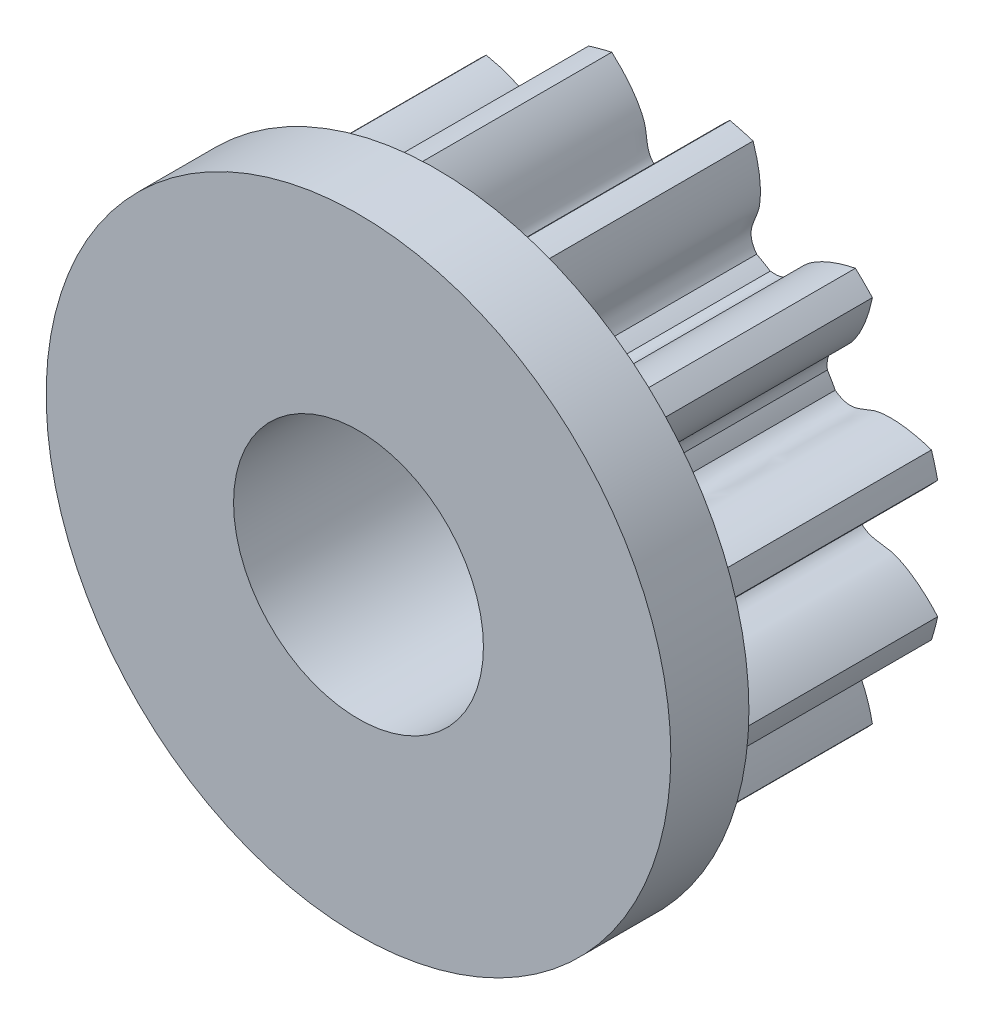
from build123d import *

# Parameters (mm, degrees)
SKETCH_1_R               = 3.5
EXTRUDE_1_DEPTH          = 3
CUT_EXTRUDE_1_DEPTH      = 6.787918451
PATTERN_CIRCULAR_1_COUNT = 12
SKETCH_5_R               = 4
EXTRUDE_2_DEPTH          = 1
SKETCH_6_R               = 1.6
CUT_EXTRUDE_2_DEPTH      = 10


with BuildPart() as part:
    # 草图1 → 凸台-拉伸1 (new body)
    with BuildSketch(Plane.XY):
        Circle(SKETCH_1_R)
    extrude(amount=EXTRUDE_1_DEPTH)

    # 草图2 → 切除-拉伸1 (cut, through all)
    with BuildSketch(Plane.XY):
        with BuildLine():
            ThreePointArc((0.100420056, 2.372876063), (0, 2.375), (-0.100420056, 2.372876063))
            add(Edge.make_bspline(
                [(-0.100420056, 2.372876063), (-0.340394435, 2.474653731), (-0.287186739, 2.672409341), (-0.338076094, 2.844740289), (-0.341311927, 2.854952869), (-0.345113625, 2.866166713), (-0.349521434, 2.878363044), (-0.354576313, 2.891521619), (-0.360318258, 2.905621034), (-0.36678678, 2.920638648), (-0.374020716, 2.936550626), (-0.382058239, 2.95333195), (-0.390936819, 2.970956436), (-0.400693193, 2.989396753), (-0.411363332, 3.008624444), (-0.422982412, 3.02860994), (-0.435584786, 3.049322589), (-0.449203949, 3.07073067), (-0.463872517, 3.092801417), (-0.479622192, 3.115501045), (-0.496483738, 3.138794769), (-0.514486952, 3.162646832), (-0.533660639, 3.187020528), (-0.554032585, 3.211878226), (-0.575629533, 3.237181399), (-0.598477155, 3.262890651), (-0.622600033, 3.288965742), (-0.648021632, 3.315365616), (-0.674764279, 3.342048434), (-0.702849139, 3.368971597), (-0.732296196, 3.396091781), (-0.763124233, 3.423364967), (-0.795350811, 3.450746465), (-0.828992247, 3.478190957), (-0.864063604, 3.505652518), (-0.900578664, 3.533084654), (-0.938549918, 3.560440334), (-0.977988547, 3.587672024), (-1.01890441, 3.614731718), (-1.061306025, 3.641570973), (-1.10520056, 3.668140947), (-1.150593819, 3.694392428), (-1.197490231, 3.720275872), (-1.245892835, 3.74574144), (-1.295803277, 3.770739031), (-1.347221796, 3.79521832), (-1.400147219, 3.819128792), (-1.454576948, 3.842419781), (-1.510506963, 3.865040505), (-1.567931802, 3.886940103), (-1.647189853, 3.915363979), (-1.7077968, 3.935050704), (-1.748802701, 3.947485455)],
                knots=[0, 0, 0, 0, 0.218015236, 0.222043642, 0.226545979, 0.231522246, 0.236972443, 0.24289657, 0.249294627, 0.256166614, 0.263512532, 0.271332379, 0.279626157, 0.288393865, 0.297635503, 0.307351072, 0.31754057, 0.328203999, 0.339341357, 0.350952646, 0.363037866, 0.375597015, 0.388630094, 0.402137104, 0.416118043, 0.430572913, 0.445501713, 0.460904444, 0.476781104, 0.493131694, 0.509956215, 0.527254666, 0.545027047, 0.563273358, 0.581993599, 0.601187771, 0.620855872, 0.640997904, 0.661613866, 0.682703758, 0.704267581, 0.726305333, 0.748817015, 0.771802628, 0.795262171, 0.819195644, 0.843603047, 0.868484381, 0.893839644, 0.919668838, 0.945971962, 1, 1, 1, 1], degree=3))
            ThreePointArc((-1.748802701, 3.947485455), (0, 4.317516914), (1.748802701, 3.947485455))
            add(Edge.make_bspline(
                [(0.100420056, 2.372876063), (0.340394435, 2.474653731), (0.287186739, 2.672409341), (0.338076094, 2.844740289), (0.341311927, 2.854952869), (0.345113625, 2.866166713), (0.349521434, 2.878363044), (0.354576313, 2.891521619), (0.360318258, 2.905621034), (0.36678678, 2.920638648), (0.374020716, 2.936550626), (0.382058239, 2.95333195), (0.390936819, 2.970956436), (0.400693193, 2.989396753), (0.411363332, 3.008624444), (0.422982412, 3.02860994), (0.435584786, 3.049322589), (0.449203949, 3.07073067), (0.463872517, 3.092801417), (0.479622192, 3.115501045), (0.496483738, 3.138794769), (0.514486952, 3.162646832), (0.533660639, 3.187020528), (0.554032585, 3.211878226), (0.575629533, 3.237181399), (0.598477155, 3.262890651), (0.622600033, 3.288965742), (0.648021632, 3.315365616), (0.674764279, 3.342048434), (0.702849139, 3.368971597), (0.732296196, 3.396091781), (0.763124233, 3.423364967), (0.795350811, 3.450746465), (0.828992247, 3.478190957), (0.864063604, 3.505652518), (0.900578664, 3.533084654), (0.938549918, 3.560440334), (0.977988547, 3.587672024), (1.01890441, 3.614731718), (1.061306025, 3.641570973), (1.10520056, 3.668140947), (1.150593819, 3.694392428), (1.197490231, 3.720275872), (1.245892835, 3.74574144), (1.295803277, 3.770739031), (1.347221796, 3.79521832), (1.400147219, 3.819128792), (1.454576948, 3.842419781), (1.510506963, 3.865040505), (1.567931802, 3.886940103), (1.647189853, 3.915363979), (1.7077968, 3.935050704), (1.748802701, 3.947485455)],
                knots=[0, 0, 0, 0, 0.218015236, 0.222043642, 0.226545979, 0.231522246, 0.236972443, 0.24289657, 0.249294627, 0.256166614, 0.263512532, 0.271332379, 0.279626157, 0.288393865, 0.297635503, 0.307351072, 0.31754057, 0.328203999, 0.339341357, 0.350952646, 0.363037866, 0.375597015, 0.388630094, 0.402137104, 0.416118043, 0.430572913, 0.445501713, 0.460904444, 0.476781104, 0.493131694, 0.509956215, 0.527254666, 0.545027047, 0.563273358, 0.581993599, 0.601187771, 0.620855872, 0.640997904, 0.661613866, 0.682703758, 0.704267581, 0.726305333, 0.748817015, 0.771802628, 0.795262171, 0.819195644, 0.843603047, 0.868484381, 0.893839644, 0.919668838, 0.945971962, 1, 1, 1, 1], degree=3))
        make_face()
    cut_extrude_1 = extrude(amount=CUT_EXTRUDE_1_DEPTH, mode=Mode.SUBTRACT)

    # 阵列(圆周)1: 切除-拉伸1 ×12 about axis
    pattern_circular_1_axis = Axis((0, 0, 3), (0, 0, -1))
    for i in range(1, PATTERN_CIRCULAR_1_COUNT):
        add(cut_extrude_1.rotate(pattern_circular_1_axis, i * 360 / PATTERN_CIRCULAR_1_COUNT), mode=Mode.SUBTRACT)

    # 草图5 → 凸台-拉伸2 (add)
    with BuildSketch(Plane.XY.offset(3)):
        Circle(SKETCH_5_R)
    extrude(amount=EXTRUDE_2_DEPTH)

    # 草图6 → 切除-拉伸2 (cut)
    with BuildSketch(Plane.XY.offset(4)):
        Circle(SKETCH_6_R)
    extrude(amount=-CUT_EXTRUDE_2_DEPTH, mode=Mode.SUBTRACT)


solid = part.part
